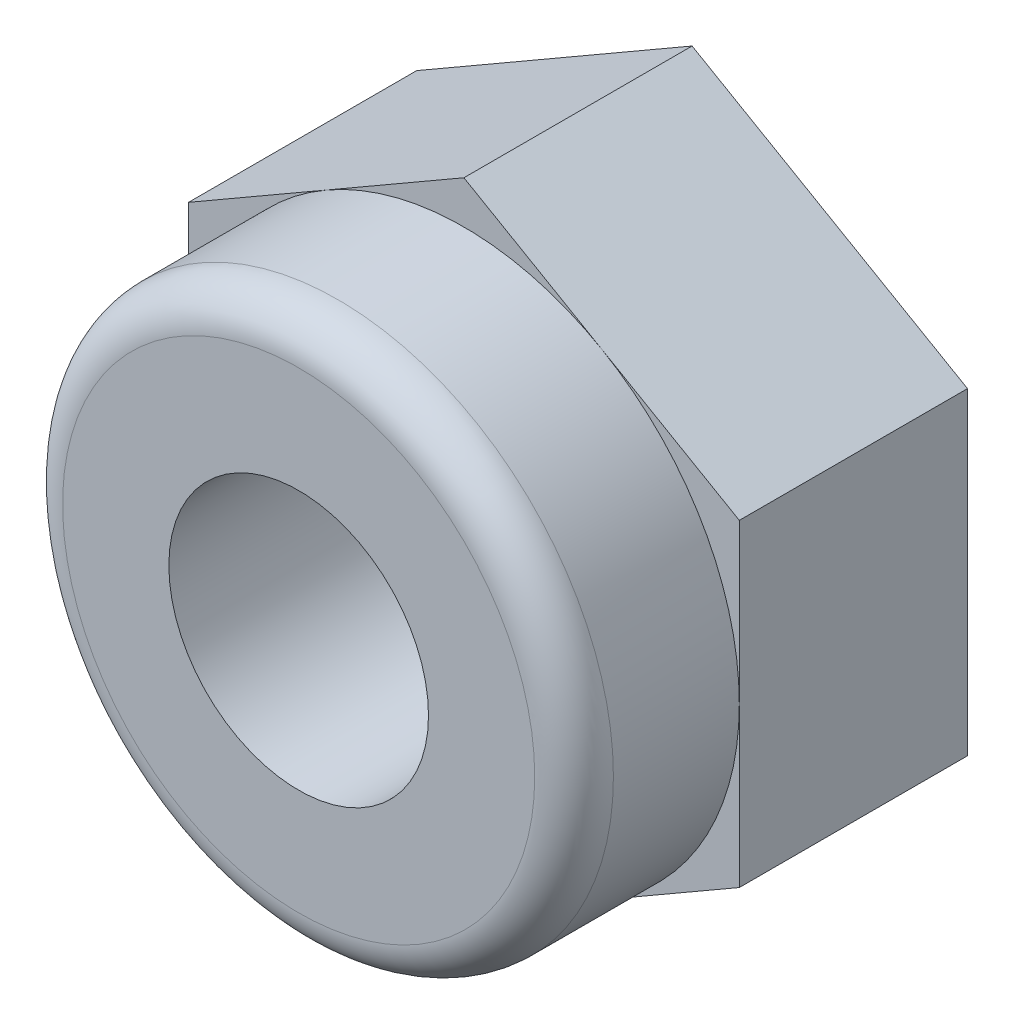
from build123d import *

# Parameters (mm, degrees)
EXTRUDE_1_DEPTH    = 2.9
SKETCH_2_R         = 3.5
EXTRUDE_2_DEPTH    = 2.1
FILLET_1_R         = 0.5
HOLE_WIZARD_M4_1_D = 3.3


with BuildPart() as part:
    # 草图1 → 凸台-拉伸1 (new body)
    with BuildSketch(Plane.XY):
        Polygon((0, 4.041451884), (-3.5, 2.020725942), (-3.5, -2.020725942), (0, -4.041451884), (3.5, -2.020725942), (3.5, 2.020725942), align=None)
    extrude(amount=EXTRUDE_1_DEPTH)

    # 草图2 → 凸台-拉伸2 (add)
    with BuildSketch(Plane.XY.offset(2.9)):
        Circle(SKETCH_2_R)
    extrude(amount=EXTRUDE_2_DEPTH)

    # 圆角1
    fillet_1_edges = [part.edges().sort_by_distance(p)[0] for p in [
        (-3.5, 0, 5),
    ]]
    fillet(fillet_1_edges, radius=FILLET_1_R)

    # M4 螺纹孔1 (through all)
    with Locations(Plane.XY.offset(5)):
        with Locations((0, 0)):
            Hole(HOLE_WIZARD_M4_1_D / 2)


solid = part.part
